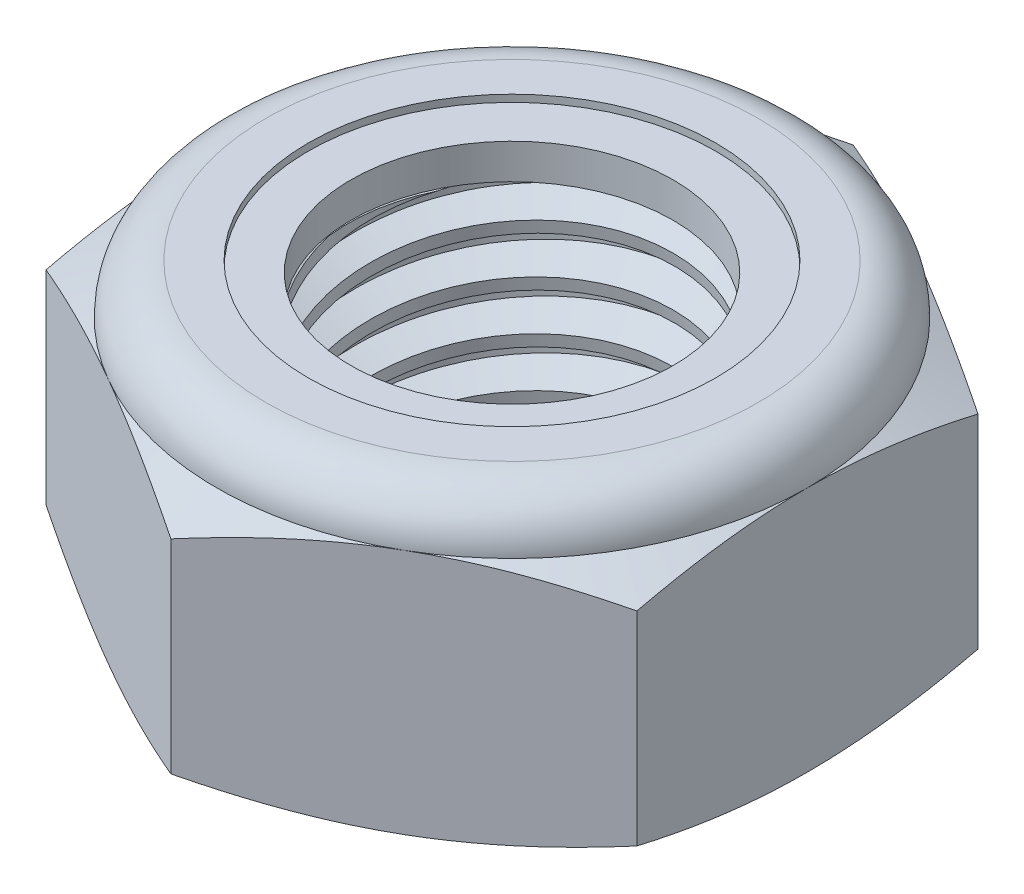
from build123d import *

# Parameters (mm, degrees)
EXTRUDE1_DEPTH      = 6.35
SKETCH2_W           = 3.96875
SKETCH2_H           = 6.35
LPATTERN1_COUNT     = 6
LPATTERN1_PITCH     = 1.058333333
LPATTERN1_COL_COUNT = 2
LPATTERN1_COL_PITCH = 1.058333333


with BuildPart() as part:
    # Sketch1 → Extrude1 (new body)
    with BuildSketch(Plane(origin=(0, 0, 0), x_dir=(1, 0, 0), z_dir=(0, 1, 0))):
        Polygon((0, 7.332348419), (-6.35, 3.666174209), (-6.35, -3.666174209), (0, -7.332348419), (6.35, -3.666174209), (6.35, 3.666174209), align=None)
    extrude(amount=EXTRUDE1_DEPTH)

    # Sketch4 → Cut-Revolve2 (revolve, cut)
    with BuildSketch(Plane(origin=(0, 0, 0), x_dir=(0, 0, -1), z_dir=(1, 0, 0)), mode=Mode.PRIVATE) as cut_revolve2_sk:
        Polygon((0, 6.35), (3.96875, 6.35), (3.462129843, 6.113759141), (3.462129843, 0.236240859), (3.96875, 0), (0, 0), align=None)
    revolve(cut_revolve2_sk.sketch.rotate(Axis((0, 6.35, 0), (0, 1, 0)), 54.856490232), axis=Axis((0, 6.35, 0), (0, 1, 0)), mode=Mode.SUBTRACT)


with BuildPart() as body_2:
    # Sketch2 → Revolve1 (revolve)
    with BuildSketch(Plane(origin=(0, 0, 0), x_dir=(0, 0, -1), z_dir=(1, 0, 0))):
        with Locations((1.984375, 3.175)):
            Rectangle(SKETCH2_W, SKETCH2_H)
    revolve(axis=Axis((0, -3.96875, 0), (0, 1, 0)))

    # Sketch3 → Cut-Revolve1 (revolve, cut)
    with BuildSketch(Plane(origin=(0, 0, 0), x_dir=(0, 0, -1), z_dir=(1, 0, 0)), mode=Mode.PRIVATE) as cut_revolve1_sk:
        Polygon((3.986234159, 6.218868809), (4.10862327, 5.300950472), (3.49709816, 5.553069821), (3.462129843, 5.815332203), align=None)
    cut_revolve1 = revolve(cut_revolve1_sk.sketch.rotate(Axis((0, 6.35, 0.150633003), (0, -0.9912279006826348, -0.13216372009101807)), 180), axis=Axis((0, 6.35, 0.150633003), (0, -0.9912279006826348, -0.13216372009101807)), mode=Mode.SUBTRACT)

    # LPattern1: Cut-Revolve1 ×6
    with Locations(*[(0, -i * LPATTERN1_PITCH, 0) for i in range(1, LPATTERN1_COUNT)]):
        add(cut_revolve1, mode=Mode.SUBTRACT)

    # LPattern1 col: Cut-Revolve1 ×2
    with Locations(*[(0, i * LPATTERN1_COL_PITCH, 0) for i in range(1, LPATTERN1_COL_COUNT)]):
        add(cut_revolve1, mode=Mode.SUBTRACT)


with BuildPart() as part_1:
    add(part.part)

    # Combine1: cut body 2
    add(body_2.part, mode=Mode.SUBTRACT)

    # Sketch5 → Cut-Revolve3 (revolve, cut)
    with BuildSketch(Plane(origin=(0, 0, 0), x_dir=(0, 0, -1), z_dir=(1, 0, 0)), mode=Mode.PRIVATE) as cut_revolve3_sk:
        with BuildLine():
            Line((0, 0), (6.35, 0))
            Line((6.35, 0), (7.332348419, 0.458076591))
            Line((7.332348419, 0.458076591), (7.332348419, 4.833590076))
            Line((7.332348419, 4.833590076), (6.35, 5.291666667))
            ThreePointArc((6.35, 5.291666667), (6.040021343, 6.040021343), (5.291666667, 6.35))
            Line((5.291666667, 6.35), (5.291666667, 7.62))
            Line((5.291666667, 7.62), (8.602348419, 7.62))
            Line((8.602348419, 7.62), (8.602348419, -1.27))
            Line((8.602348419, -1.27), (0, -1.27))
            Line((0, -1.27), (0, 0))
        make_face()
    revolve(cut_revolve3_sk.sketch.rotate(Axis((0, 0, 0), (0, 1, 0)), 54.866222378), axis=Axis((0, 0, 0), (0, 1, 0)), mode=Mode.SUBTRACT)

    # Sketch6 → Cut-Revolve4 (revolve, cut)
    with BuildSketch(Plane(origin=(0, 0, 0), x_dir=(0, 0, -1), z_dir=(1, 0, 0)), mode=Mode.PRIVATE) as cut_revolve4_sk:
        with BuildLine():
            Line((0, 5.291666667), (6.1976, 5.291666667))
            ThreePointArc((6.1976, 5.291666667), (5.93225827, 5.93225827), (5.291666667, 6.1976))
            Line((5.291666667, 6.1976), (4.376898255, 6.1976))
            Line((4.376898255, 6.1976), (4.376898255, 7.62))
            Line((4.376898255, 7.62), (0, 7.62))
            Line((0, 7.62), (0, 5.291666667))
        make_face()
    revolve(cut_revolve4_sk.sketch.rotate(Axis((0, 7.62, 0), (0, 1, 0)), 54.856490232), axis=Axis((0, 7.62, 0), (0, 1, 0)), mode=Mode.SUBTRACT)


with BuildPart() as body_2_2:
    # Sketch7 → Revolve2 (revolve)
    with BuildSketch(Plane(origin=(0, 0, 0), x_dir=(0, 0, -1), z_dir=(1, 0, 0))):
        with BuildLine():
            Line((3.462129843, 5.367866667), (6.117893612, 5.367866667))
            ThreePointArc((6.117893612, 5.367866667), (5.850787282, 5.904725834), (5.291666667, 6.1214))
            Line((5.291666667, 6.1214), (3.462129843, 6.1214))
            Line((3.462129843, 6.1214), (3.462129843, 5.367866667))
        make_face()
    revolve(axis=Axis((0, 5.367866667, 0), (0, 1, 0)))


solid = Compound([part_1.part, body_2_2.part])
